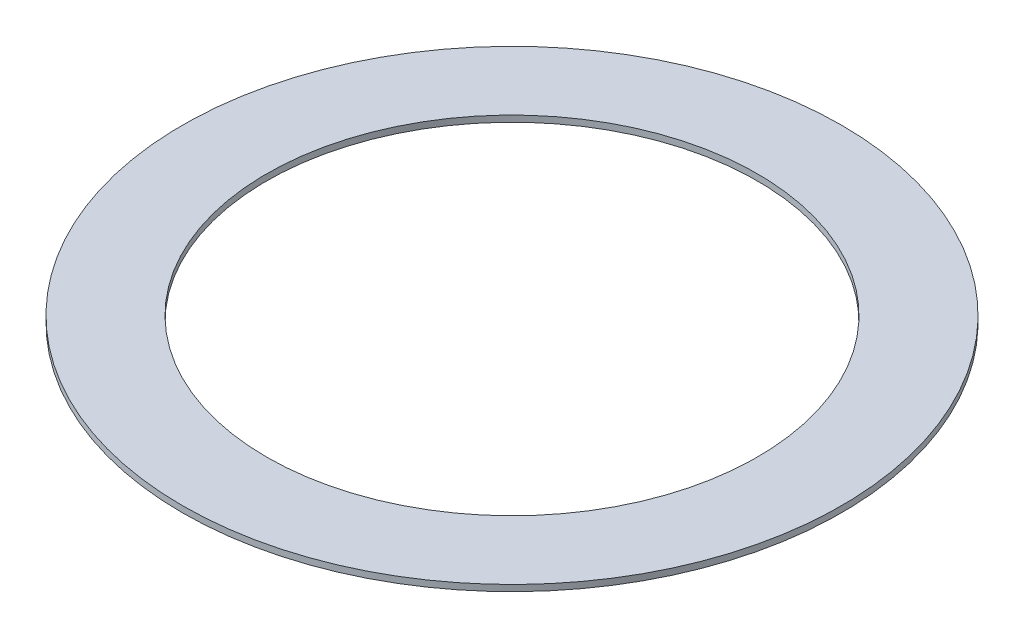
from build123d import *

# Parameters (mm, degrees)
SKETCH1_R           = 158.636590549
SKETCH1_R_2         = 118.120967126
BOSS_EXTRUDE1_DEPTH = 3


with BuildPart() as part:
    # Sketch1 → Boss-Extrude1 (new body)
    with BuildSketch(Plane(origin=(0, 0, 0), x_dir=(1, 0, 0), z_dir=(0, 1, 0))):
        with Locations(Location((0, 0, 0), (0, 0, 270))):
            Circle(SKETCH1_R)
        with Locations(Location((0, 0, 0), (0, 0, 270))):
            Circle(SKETCH1_R_2, mode=Mode.SUBTRACT)
    extrude(amount=BOSS_EXTRUDE1_DEPTH)


solid = part.part
